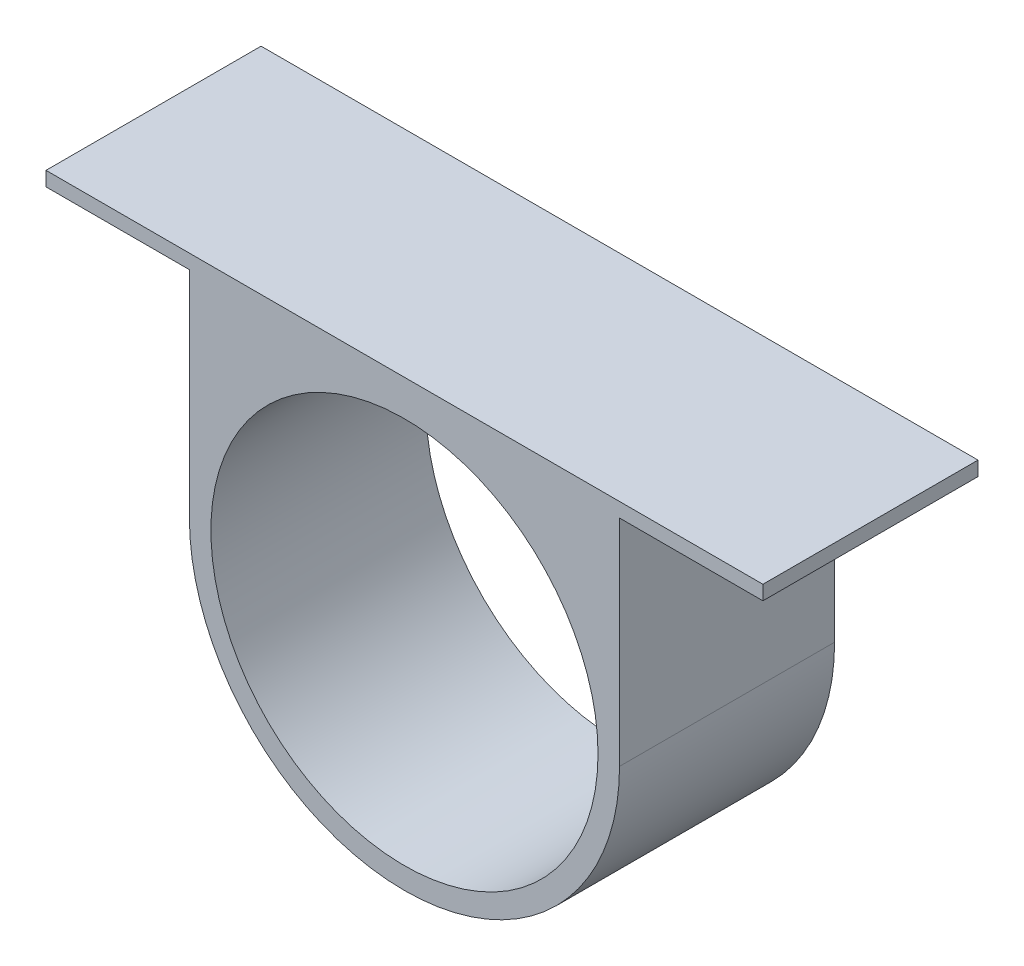
from build123d import *

# Parameters (mm, degrees)
SKETCH1_R           = 13.5
BOSS_EXTRUDE1_DEPTH = 15


with BuildPart() as part:
    # Sketch1 → Boss-Extrude1 (new body)
    with BuildSketch(Plane.XY):
        with BuildLine():
            Line((-15, 0), (-15, 15))
            Line((-15, 15), (-25, 15))
            Line((-25, 15), (-25, 16))
            Line((-25, 16), (25, 16))
            Line((25, 16), (25, 15))
            Line((25, 15), (15, 15))
            Line((15, 15), (15, 0))
            ThreePointArc((15, 0), (0, -15), (-15, 0))
        make_face()
        Circle(SKETCH1_R, mode=Mode.SUBTRACT)
    extrude(amount=BOSS_EXTRUDE1_DEPTH)


solid = part.part
